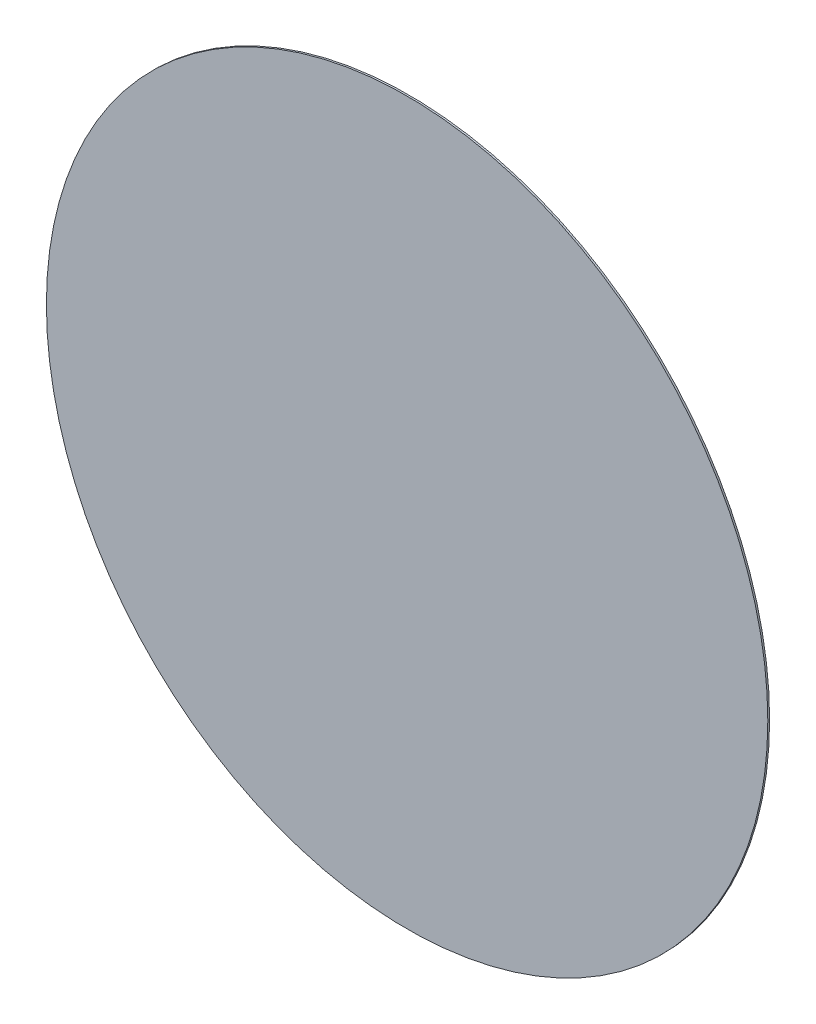
from build123d import *

# Parameters (mm, degrees)
SKETCH_1_R      = 200
EXTRUDE_1_DEPTH = 1


with BuildPart() as part:
    # 草图1 → 凸台-拉伸1 (new body)
    with BuildSketch(Plane.XY):
        Circle(SKETCH_1_R)
    extrude(amount=EXTRUDE_1_DEPTH)


solid = part.part
